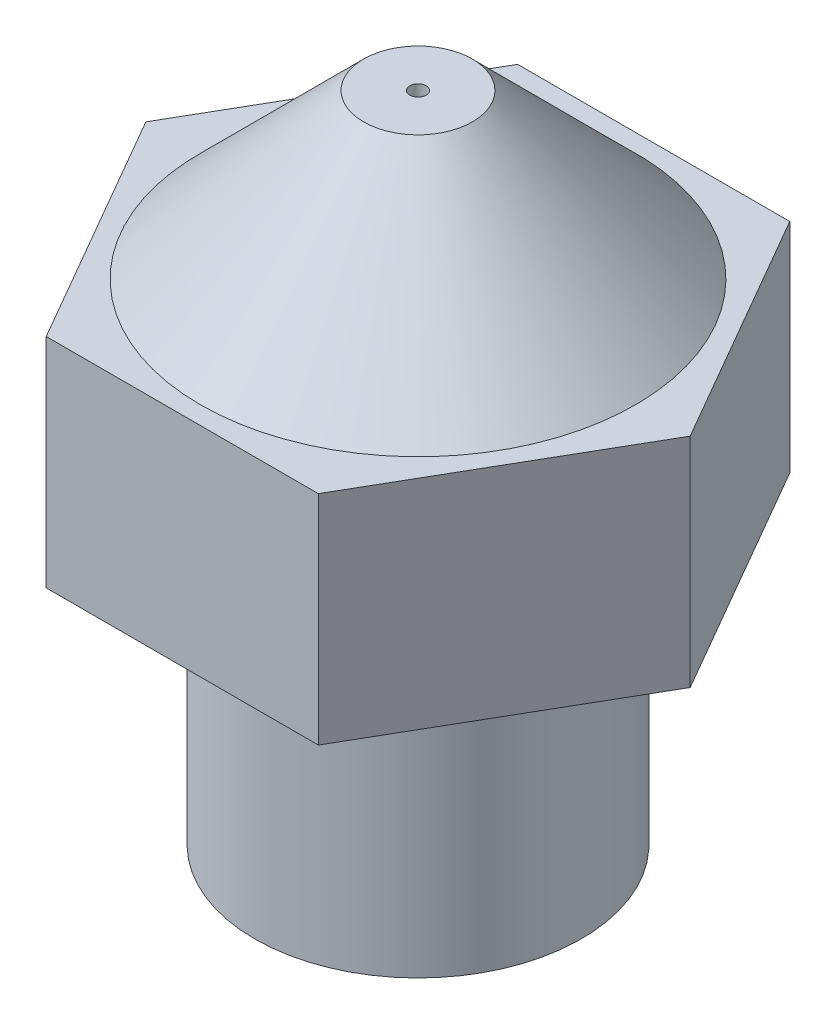
from build123d import *

# Parameters (mm, degrees)
SKETCH1_R           = 3
BOSS_EXTRUDE1_DEPTH = 5
BOSS_EXTRUDE2_DEPTH = 4
SKETCH4_R           = 1
BOSS_EXTRUDE4_DEPTH = 3
DRAFT4_ANGLE        = 45
SKETCH5_R           = 0.15
CUT_EXTRUDE1_DEPTH  = 50
SKETCH6_R           = 1.5
CUT_EXTRUDE2_DEPTH  = 5


with BuildPart() as part:
    # Sketch1 → Boss-Extrude1 (new body)
    with BuildSketch(Plane(origin=(0, 0, 0), x_dir=(1, 0, 0), z_dir=(0, 1, 0))):
        with Locations(Location((0, 0, 0), (0, 0, 270))):
            Circle(SKETCH1_R)
    extrude(amount=BOSS_EXTRUDE1_DEPTH)

    # Sketch2 → Boss-Extrude2 (add)
    with BuildSketch(Plane(origin=(0, 5, 0), x_dir=(1, 0, 0), z_dir=(0, 1, 0))):
        Polygon((5, 0), (2.5, 4.330127019), (-2.5, 4.330127019), (-5, 0), (-2.5, -4.330127019), (2.5, -4.330127019), align=None)
    extrude(amount=BOSS_EXTRUDE2_DEPTH)

    # Sketch4 → Boss-Extrude4 (add)
    with BuildSketch(Plane(origin=(0, 9, 0), x_dir=(1, 0, 0), z_dir=(0, 1, 0))):
        with Locations(Location((0, 0, 0), (0, 0, 270))):
            Circle(SKETCH4_R)
    extrude(amount=BOSS_EXTRUDE4_DEPTH)

    # Draft4
    draft4_faces = [part.faces().sort_by_distance(p)[0] for p in [
        (0, 10.5, -1),
    ]]
    draft(draft4_faces, Plane.ZX.offset(12), DRAFT4_ANGLE)

    # Sketch5 → Cut-Extrude1 (cut)
    with BuildSketch(Plane(origin=(0, 12, 0), x_dir=(1, 0, 0), z_dir=(0, 1, 0))):
        with Locations(Location((0, 0, 0), (0, 0, 270))):
            Circle(SKETCH5_R)
    extrude(amount=-CUT_EXTRUDE1_DEPTH, mode=Mode.SUBTRACT)

    # Sketch6 → Cut-Extrude2 (cut)
    with BuildSketch(Plane.XZ):
        with Locations(Location((0, 0, 0), (0, 0, 270))):
            Circle(SKETCH6_R)
    extrude(amount=-CUT_EXTRUDE2_DEPTH, mode=Mode.SUBTRACT)


solid = part.part
